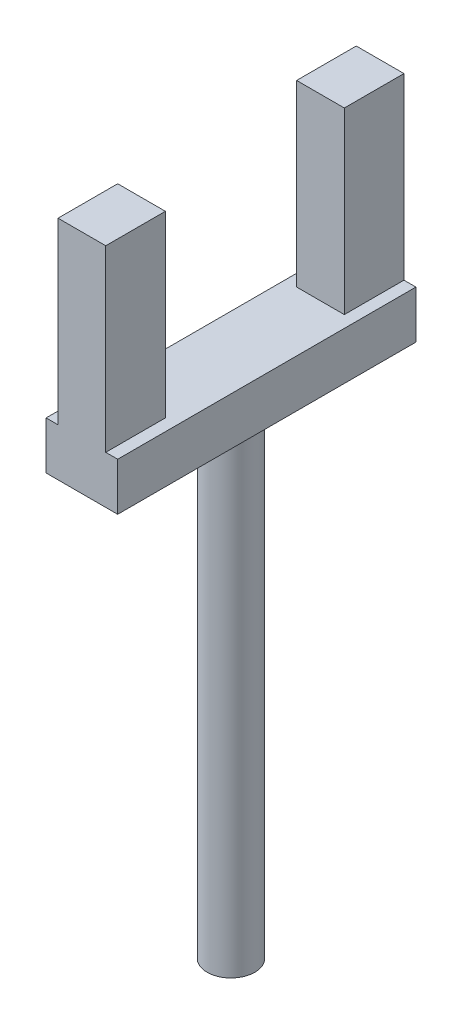
from build123d import *

# Parameters (mm, degrees)
SKETCH1_R                = 10
BOSS_EXTRUDE1_DEPTH      = 200
BOSS_EXTRUDE2_DEPTH      = 15
BOSS_EXTRUDE2_DEPTH_BACK = 15
SKETCH2_W                = 125
SKETCH2_H                = 20
BOSS_EXTRUDE3_DEPTH      = 10
BOSS_EXTRUDE3_DEPTH_BACK = 10
SKETCH3_W                = 25
SKETCH3_H                = 75


with BuildPart() as part:
    # Sketch1 → Boss-Extrude1 (new body)
    with BuildSketch(Plane(origin=(0, 0, 0), x_dir=(1, 0, 0), z_dir=(0, 1, 0))):
        Circle(SKETCH1_R)
    extrude(amount=BOSS_EXTRUDE1_DEPTH)

    # Sketch2 → Boss-Extrude2 (add, two sides: drawn at the far end of the back side and taken through both)
    with BuildSketch(Plane(origin=(0, 0, 0), x_dir=(0, 0, -1), z_dir=(1, 0, 0)).offset(-BOSS_EXTRUDE2_DEPTH_BACK)):
        with Locations((0, 210)):
            Rectangle(SKETCH2_W, SKETCH2_H)
    extrude(amount=BOSS_EXTRUDE2_DEPTH + BOSS_EXTRUDE2_DEPTH_BACK)

    # Sketch3 → Boss-Extrude3 (add, two sides: drawn at the far end of the back side and taken through both)
    with BuildSketch(Plane(origin=(0, 0, 0), x_dir=(0, 0, -1), z_dir=(1, 0, 0)).offset(-BOSS_EXTRUDE3_DEPTH_BACK)):
        with Locations((-50, 257.5)):
            Rectangle(SKETCH3_W, SKETCH3_H)
        with Locations((50, 257.5)):
            Rectangle(SKETCH3_W, SKETCH3_H)
    extrude(amount=BOSS_EXTRUDE3_DEPTH + BOSS_EXTRUDE3_DEPTH_BACK)


solid = part.part
